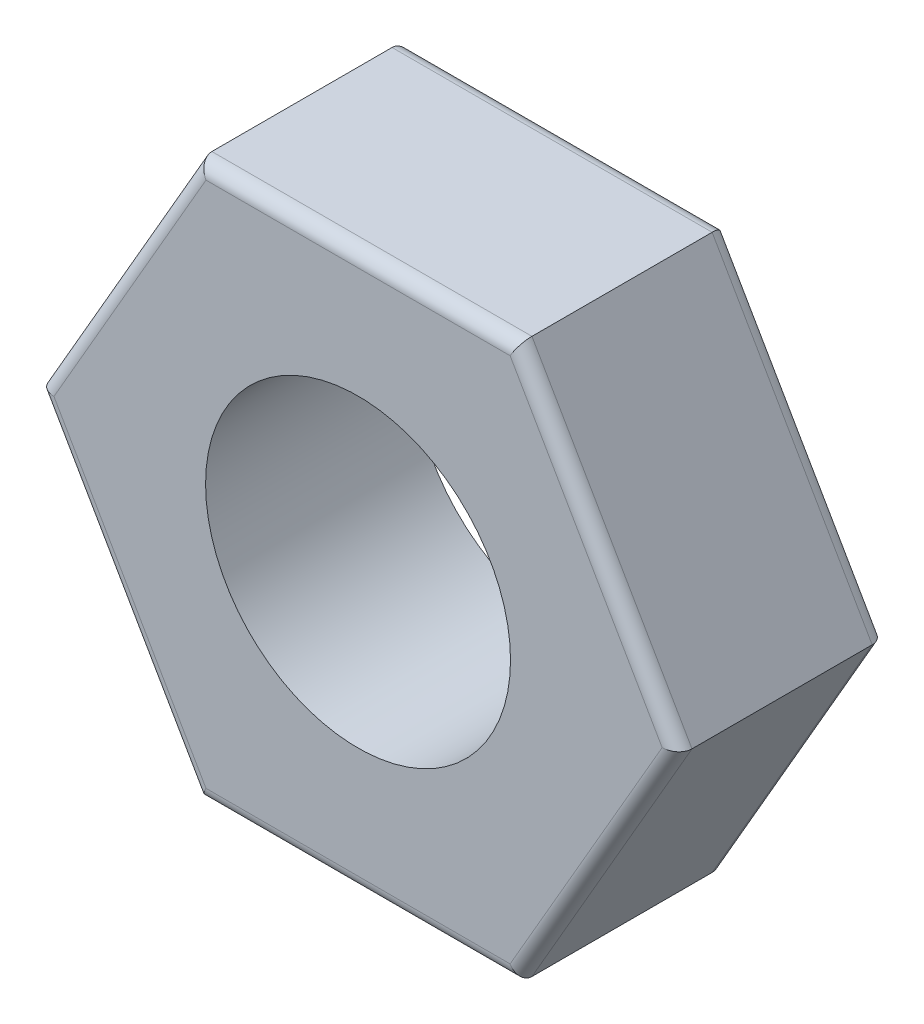
from build123d import *

# Parameters (mm, degrees)
EXTRUDE_3_DEPTH     = 15
FILLET_3_R          = 1
SKETCH_4_R          = 11
CUT_EXTRUDE_1_DEPTH = 35.034296428


with BuildPart() as part:
    # 草图1 → 凸台-拉伸3 (new body)
    with BuildSketch(Plane.XY):
        Polygon((11.547005384, -20), (23.094010768, 0), (11.547005384, 20), (-11.547005384, 20), (-23.094010768, 0), (-11.547005384, -20), align=None)
    extrude(amount=EXTRUDE_3_DEPTH)

    # 圆角3
    fillet_3_edges = [part.edges().sort_by_distance(p)[0] for p in [
        (17.320508076, 10, 15),
        (0, 20, 15),
        (-17.320508076, 10, 15),
        (-17.320508076, -10, 15),
        (0, -20, 15),
        (-17.320508076, -10, 0),
        (-17.320508076, 10, 0),
        (0, 20, 0),
        (17.320508076, -10, 15),
        (17.320508076, 10, 0),
        (17.320508076, -10, 0),
        (0, -20, 0),
    ]]
    fillet(fillet_3_edges, radius=FILLET_3_R)

    # 草图4 → 切除-拉伸1 (cut, through all)
    with BuildSketch(Plane.XY.offset(15)):
        Circle(SKETCH_4_R)
    extrude(amount=-CUT_EXTRUDE_1_DEPTH, mode=Mode.SUBTRACT)


solid = part.part
